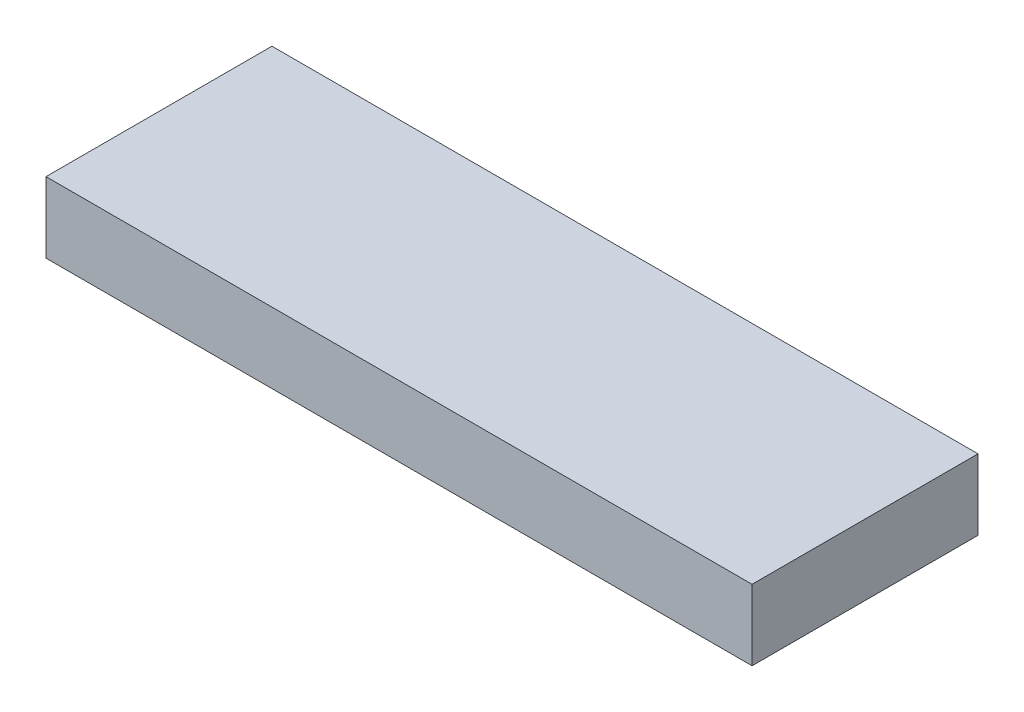
from build123d import *

# Parameters (mm, degrees)
SKETCH1_W           = 25
SKETCH1_H           = 8
BOSS_EXTRUDE1_DEPTH = 2.5


with BuildPart() as part:
    # Sketch1 → Boss-Extrude1 (new body)
    with BuildSketch(Plane(origin=(0, 0, 0), x_dir=(1, 0, 0), z_dir=(0, 1, 0))):
        with Locations((12.5, 4)):
            Rectangle(SKETCH1_W, SKETCH1_H)
    extrude(amount=BOSS_EXTRUDE1_DEPTH)


solid = part.part
